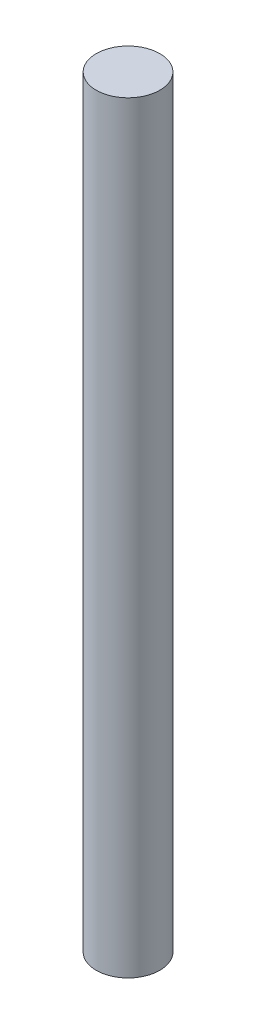
from build123d import *

# Parameters (mm, degrees)
SKETCH1_R           = 3.175
BOSS_EXTRUDE1_DEPTH = 76.2


with BuildPart() as part:
    # Sketch1 → Boss-Extrude1 (new body)
    with BuildSketch(Plane(origin=(0, 0, 0), x_dir=(1, 0, 0), z_dir=(0, 1, 0))):
        with Locations(Location((0, 0, 0), (0, 0, 90))):
            Circle(SKETCH1_R)
    extrude(amount=BOSS_EXTRUDE1_DEPTH)


solid = part.part
